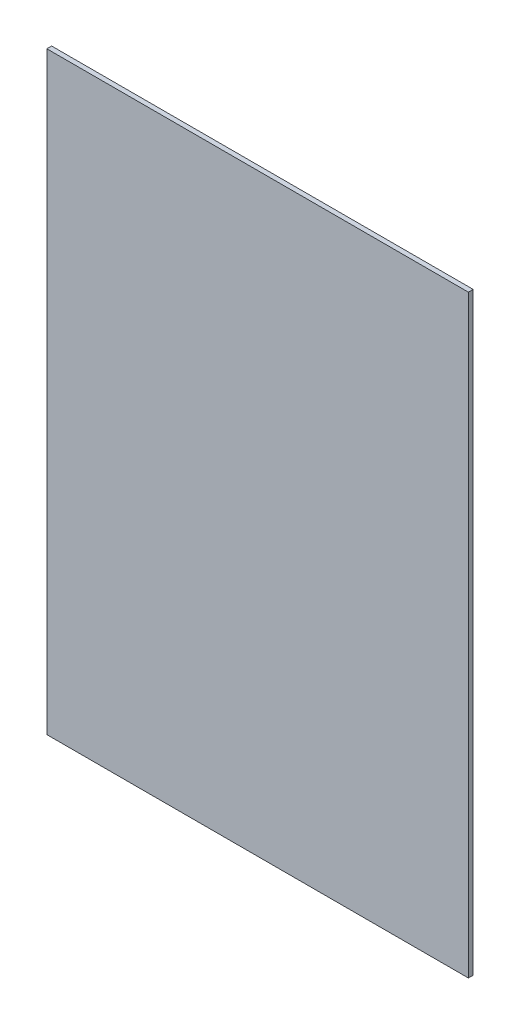
from build123d import *

# Parameters (mm, degrees)
ESQUISSE1_W        = 440
ESQUISSE1_H        = 620
BOSS_EXTRU_1_DEPTH = 5


with BuildPart() as part:
    # Esquisse1 → Boss.-Extru.1 (new body)
    with BuildSketch(Plane.XY):
        Rectangle(ESQUISSE1_W, ESQUISSE1_H)
    extrude(amount=BOSS_EXTRU_1_DEPTH)


solid = part.part
